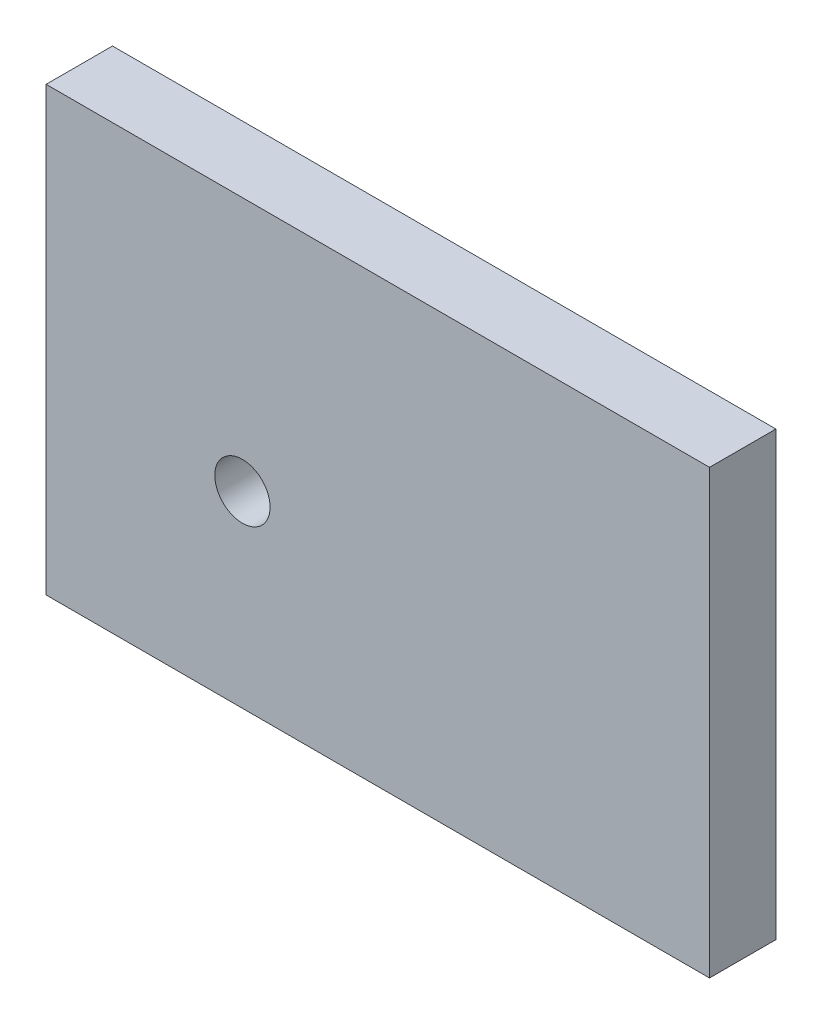
from build123d import *

# Parameters (mm, degrees)
ESQUISSE1_W             = 60
ESQUISSE1_H             = 40
BOSS_EXTRU_1_DEPTH      = 6
ESQUISSE2_R             = 2.5
ENL_V_MAT_EXTRU_1_DEPTH = 10


with BuildPart() as part:
    # Esquisse1 → Boss.-Extru.1 (new body)
    with BuildSketch(Plane.XY):
        with Locations((-30, 20)):
            Rectangle(ESQUISSE1_W, ESQUISSE1_H)
    extrude(amount=BOSS_EXTRU_1_DEPTH)

    # Esquisse2 → Enlèv. mat.-Extru.1 (cut)
    with BuildSketch(Plane(origin=(0, 0, 0), x_dir=(-1, 0, 0), z_dir=(0, 0, -1))):
        with Locations((42.245544671, 17)):
            Circle(ESQUISSE2_R)
    extrude(amount=-ENL_V_MAT_EXTRU_1_DEPTH, mode=Mode.SUBTRACT)


solid = part.part
